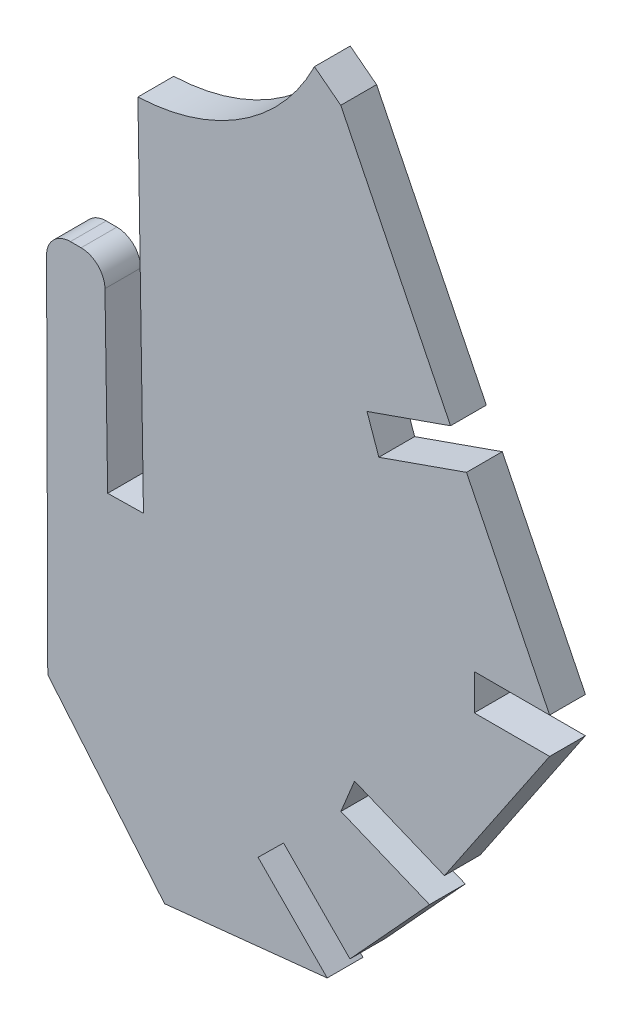
from build123d import *

# Parameters (mm, degrees)
BASE_EXTRUDE_DEPTH = 3


with BuildPart() as part:
    # Sketch1 → Base-Extrude (new body)
    with BuildSketch(Plane.XY):
        with BuildLine():
            Line((1123.682056814, 62.226353312), (1123.217824039, 92.222761229))
            ThreePointArc((1123.217824039, 92.222761229), (1131.93888948, 94.9852284), (1138.016482209, 101.822704098))
            Line((1138.016482209, 101.822704098), (1140.223428748, 100.122354582))
            Line((1140.223428748, 100.122354582), (1149.427763829, 81.453359638))
            Line((1149.427763829, 81.453359638), (1142.423370566, 78.994416072))
            Line((1142.423370566, 78.994416072), (1143.41708769, 76.163775459))
            Line((1143.41708769, 76.163775459), (1150.764055432, 78.742982306))
            Line((1150.764055432, 78.742982306), (1157.735111853, 64.603708156))
            Line((1157.735111853, 64.603708156), (1151.41486057, 64.603708156))
            Line((1151.41486057, 64.603708156), (1151.41486057, 61.603708156))
            Line((1151.41486057, 61.603708156), (1157.735111853, 61.603708156))
            Line((1157.735111853, 61.603708156), (1148.914752181, 48.53787652))
            Line((1148.914752181, 48.53787652), (1141.376892152, 51.634018924))
            Line((1141.376892152, 51.634018924), (1140.237061373, 48.858989953))
            Line((1140.237061373, 48.858989953), (1147.661839843, 45.809295294))
            Line((1147.661839843, 45.809295294), (1140.993007118, 38.529613243))
            Line((1140.993007118, 38.529613243), (1135.426293127, 44.164590139))
            Line((1135.426293127, 44.164590139), (1133.292085124, 42.056236232))
            Line((1133.292085124, 42.056236232), (1139.086791645, 36.190471003))
            Line((1139.086791645, 36.190471003), (1125.452564162, 34.76659158))
            Line((1125.452564162, 34.76659158), (1115.659628086, 46.499294412))
            Line((1115.659628086, 46.499294412), (1115.559210016, 76.887215732))
            ThreePointArc((1115.559210016, 76.887215732), (1116.142650811, 78.305699753), (1117.559199096, 78.893824774))
            Line((1117.559199096, 78.893824774), (1118.454460183, 78.893824774))
            ThreePointArc((1118.454460183, 78.893824774), (1119.857689012, 78.318938401), (1120.454220711, 76.924773625))
            Line((1120.454220711, 76.924773625), (1120.682416022, 62.179930034))
            Line((1120.682416022, 62.179930034), (1123.682056814, 62.226353312))
        make_face()
    extrude(amount=BASE_EXTRUDE_DEPTH)


solid = part.part
